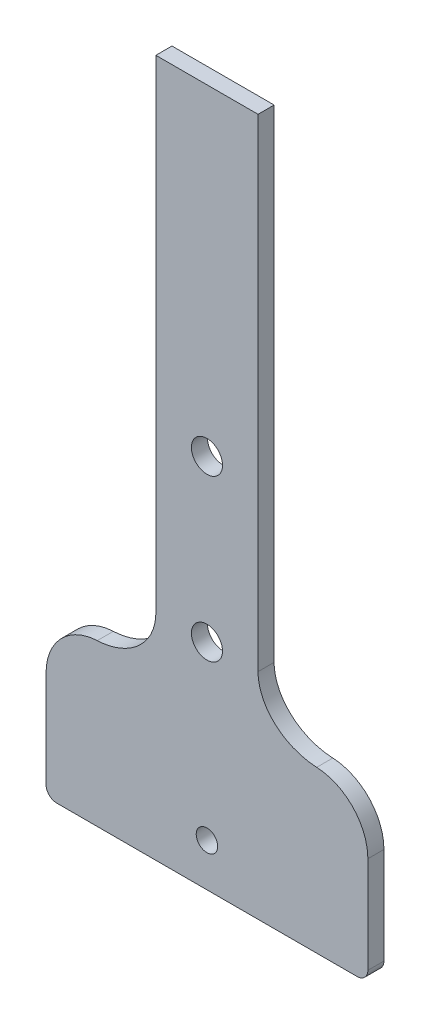
from build123d import *

# Parameters (mm, degrees)
SKETCH1_R           = 1
SKETCH1_R_2         = 1.45
BOSS_EXTRUDE1_DEPTH = 1.5


with BuildPart() as part:
    # Sketch1 → Boss-Extrude1 (new body)
    with BuildSketch(Plane.XY):
        with BuildLine():
            Line((1, 0), (29, 0))
            ThreePointArc((29, 0), (29.707106781, 0.292893219), (30, 1))
            Line((30, 1), (30, 10.010805278))
            add(Edge.make_bspline(
                [(30, 10.010805278), (30, 10.331309343), (29.969485344, 10.646616833), (29.849948512, 11.267268119), (29.75966755, 11.575507617), (29.52283644, 12.166717494), (29.377858407, 12.44760172), (29.03567781, 12.980427757), (28.836063124, 13.234342382), (28.398424751, 13.693093363), (28.159679219, 13.900081722), (27.642024265, 14.268934545), (27.362921955, 14.429904426), (26.787626221, 14.692448411), (26.488674786, 14.796208342), (25.867413661, 14.94687591), (25.550156827, 14.992309833), (25.229989605, 15.007057677)],
                knots=[0, 0, 0, 0, 0.125, 0.125, 0.25, 0.25, 0.375, 0.375, 0.5, 0.5, 0.625, 0.625, 0.75, 0.75, 0.875, 0.875, 1, 1, 1, 1], degree=3))
            add(Edge.make_bspline(
                [(19.763139721, 20), (19.763139721, 15.258876858), (25.229989605, 15.007057677)],
                knots=[0, 0, 0, 1.517657498, 1.517657498, 1.517657498], degree=2, weights=[1, 0.725642413, 1]))
            Line((19.763139721, 20), (19.763139721, 65))
            Line((19.763139721, 65), (10.236860279, 65))
            Line((10.236860279, 65), (10.236860279, 20))
            add(Edge.make_bspline(
                [(4.770010395, 15.007057677), (10.236860279, 15.258876858), (10.236860279, 20)],
                knots=[4.765527809, 4.765527809, 4.765527809, 6.283185307, 6.283185307, 6.283185307], degree=2, weights=[1, 0.725642413, 1]))
            add(Edge.make_bspline(
                [(4.770010395, 15.007057677), (4.449845357, 14.992309934), (4.136282013, 14.947292066), (3.521812442, 14.799220851), (3.218062701, 14.694770205), (2.638478447, 14.430814604), (2.364622125, 14.272965812), (1.848237929, 13.906408033), (1.60386949, 13.695209671), (1.16596165, 13.236750613), (0.970282062, 12.988644641), (0.625834171, 12.454385704), (0.478004619, 12.168149386), (0.242397802, 11.581322908), (0.15257366, 11.277880984), (0.03075096, 10.650270556), (0, 10.331307007), (0, 10.010805278)],
                knots=[0, 0, 0, 0, 0.125, 0.125, 0.25, 0.25, 0.375, 0.375, 0.5, 0.5, 0.625, 0.625, 0.75, 0.75, 0.875, 0.875, 1, 1, 1, 1], degree=3))
            Line((0, 10.010805278), (0, 1))
            ThreePointArc((0, 1), (0.292893219, 0.292893219), (1, 0))
        make_face()
        with Locations((15, 4)):
            Circle(SKETCH1_R, mode=Mode.SUBTRACT)
        with Locations((15, 20)):
            Circle(SKETCH1_R_2, mode=Mode.SUBTRACT)
        with Locations((15, 35)):
            Circle(SKETCH1_R_2, mode=Mode.SUBTRACT)
    extrude(amount=BOSS_EXTRUDE1_DEPTH)


solid = part.part
